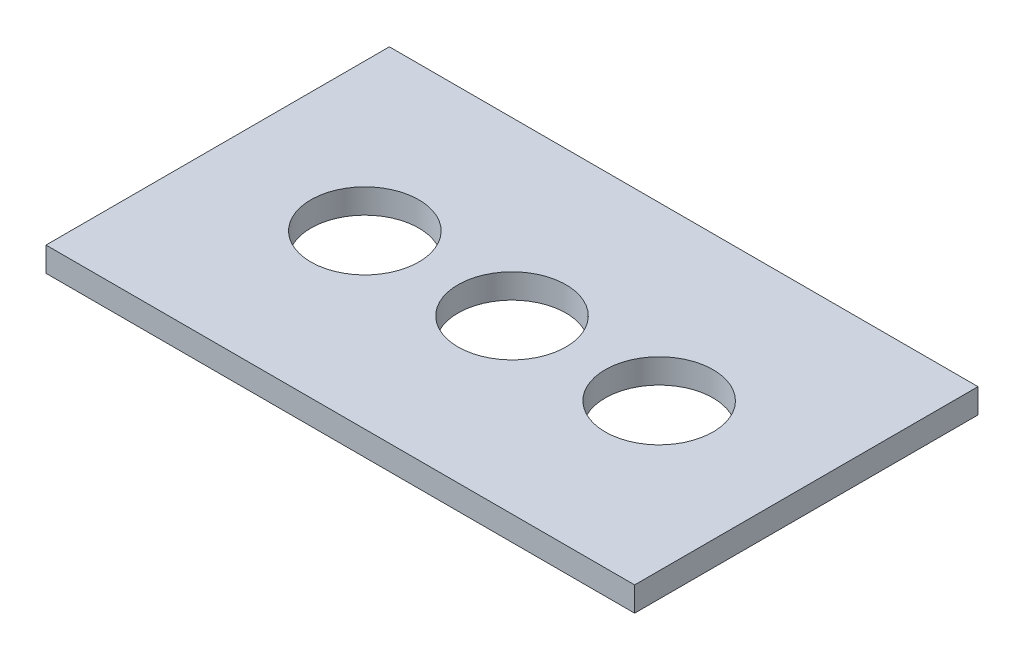
from build123d import *

# Parameters (mm, degrees)
SKETCH1_W           = 120
SKETCH1_H           = 70
BOSS_EXTRUDE1_DEPTH = 5
SKETCH2_R           = 11
CUT_EXTRUDE1_DEPTH  = 140.014387745


with BuildPart() as part:
    # Sketch1 → Boss-Extrude1 (new body)
    with BuildSketch(Plane(origin=(0, 0, 0), x_dir=(1, 0, 0), z_dir=(0, 1, 0))):
        with Locations((60, -35)):
            Rectangle(SKETCH1_W, SKETCH1_H)
    extrude(amount=BOSS_EXTRUDE1_DEPTH)

    # Sketch2 → Cut-Extrude1 (cut, through all)
    with BuildSketch(Plane(origin=(0, 5, 0), x_dir=(1, 0, 0), z_dir=(0, 1, 0))):
        with Locations(Location((30, -35, 0), (0, 0, 270))):
            Circle(SKETCH2_R)
        with Locations(Location((60, -35, 0), (0, 0, 270))):
            Circle(SKETCH2_R)
        with Locations(Location((90, -35, 0), (0, 0, 270))):
            Circle(SKETCH2_R)
    extrude(amount=-CUT_EXTRUDE1_DEPTH, mode=Mode.SUBTRACT)


solid = part.part
